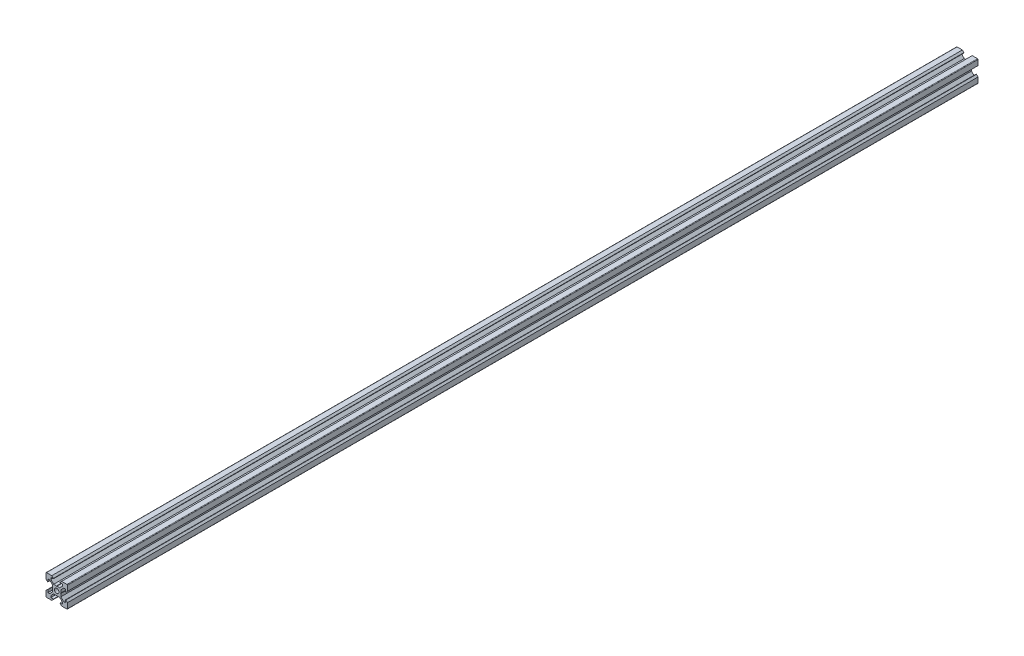
from build123d import *

# Parameters (mm, degrees)
SKETCH1_R           = 2.1
BOSS_EXTRUDE1_DEPTH = 850


with BuildPart() as part:
    # Sketch1 → Boss-Extrude1 (new body)
    with BuildSketch(Plane.XY):
        with BuildLine():
            Line((4.58, -10), (9.5, -10))
            ThreePointArc((9.5, -10), (9.853553391, -9.853553391), (10, -9.5))
            Line((10, -9.5), (10, -4.58))
            Line((10, -4.58), (8.545, -3.125))
            Line((8.545, -3.125), (8.2, -3.125))
            Line((8.2, -3.125), (8.2, -5.5))
            Line((8.2, -5.5), (6.560660172, -5.5))
            Line((6.560660172, -5.5), (3.9, -2.839339828))
            Line((3.9, -2.839339828), (3.9, -0.21))
            Line((3.9, -0.21), (3.69, 0))
            Line((3.69, 0), (3.9, 0.21))
            Line((3.9, 0.21), (3.9, 2.839339828))
            Line((3.9, 2.839339828), (6.560660172, 5.5))
            Line((6.560660172, 5.5), (8.2, 5.5))
            Line((8.2, 5.5), (8.2, 3.125))
            Line((8.2, 3.125), (8.545, 3.125))
            Line((8.545, 3.125), (10, 4.58))
            Line((10, 4.58), (10, 9.5))
            ThreePointArc((10, 9.5), (9.853553391, 9.853553391), (9.5, 10))
            Line((9.5, 10), (4.58, 10))
            Line((4.58, 10), (3.125, 8.545))
            Line((3.125, 8.545), (3.125, 8.2))
            Line((3.125, 8.2), (5.5, 8.2))
            Line((5.5, 8.2), (5.5, 6.560660172))
            Line((5.5, 6.560660172), (2.839339828, 3.9))
            Line((2.839339828, 3.9), (0.21, 3.9))
            Line((0.21, 3.9), (0, 3.69))
            Line((0, 3.69), (-0.21, 3.9))
            Line((-0.21, 3.9), (-2.839339828, 3.9))
            Line((-2.839339828, 3.9), (-5.5, 6.560660172))
            Line((-5.5, 6.560660172), (-5.5, 8.2))
            Line((-5.5, 8.2), (-3.125, 8.2))
            Line((-3.125, 8.2), (-3.125, 8.545))
            Line((-3.125, 8.545), (-4.58, 10))
            Line((-4.58, 10), (-9.5, 10))
            ThreePointArc((-9.5, 10), (-9.853553391, 9.853553391), (-10, 9.5))
            Line((-10, 9.5), (-10, 4.58))
            Line((-10, 4.58), (-8.545, 3.125))
            Line((-8.545, 3.125), (-8.2, 3.125))
            Line((-8.2, 3.125), (-8.2, 5.5))
            Line((-8.2, 5.5), (-6.560660172, 5.5))
            Line((-6.560660172, 5.5), (-3.9, 2.839339828))
            Line((-3.9, 2.839339828), (-3.9, 0.21))
            Line((-3.9, 0.21), (-3.69, 0))
            Line((-3.69, 0), (-3.9, -0.21))
            Line((-3.9, -0.21), (-3.9, -2.839339828))
            Line((-3.9, -2.839339828), (-6.560660172, -5.5))
            Line((-6.560660172, -5.5), (-8.2, -5.5))
            Line((-8.2, -5.5), (-8.2, -3.125))
            Line((-8.2, -3.125), (-8.545, -3.125))
            Line((-8.545, -3.125), (-10, -4.58))
            Line((-10, -4.58), (-10, -9.5))
            ThreePointArc((-10, -9.5), (-9.853553391, -9.853553391), (-9.5, -10))
            Line((-9.5, -10), (-4.58, -10))
            Line((-4.58, -10), (-3.125, -8.545))
            Line((-3.125, -8.545), (-3.125, -8.2))
            Line((-3.125, -8.2), (-5.5, -8.2))
            Line((-5.5, -8.2), (-5.5, -6.560660172))
            Line((-5.5, -6.560660172), (-2.839339828, -3.9))
            Line((-2.839339828, -3.9), (-0.21, -3.9))
            Line((-0.21, -3.9), (0, -3.69))
            Line((0, -3.69), (0.21, -3.9))
            Line((0.21, -3.9), (2.839339828, -3.9))
            Line((2.839339828, -3.9), (5.5, -6.560660172))
            Line((5.5, -6.560660172), (5.5, -8.2))
            Line((5.5, -8.2), (3.125, -8.2))
            Line((3.125, -8.2), (3.125, -8.545))
            Line((3.125, -8.545), (4.58, -10))
        make_face()
        Circle(SKETCH1_R, mode=Mode.SUBTRACT)
    extrude(amount=BOSS_EXTRUDE1_DEPTH)


solid = part.part
